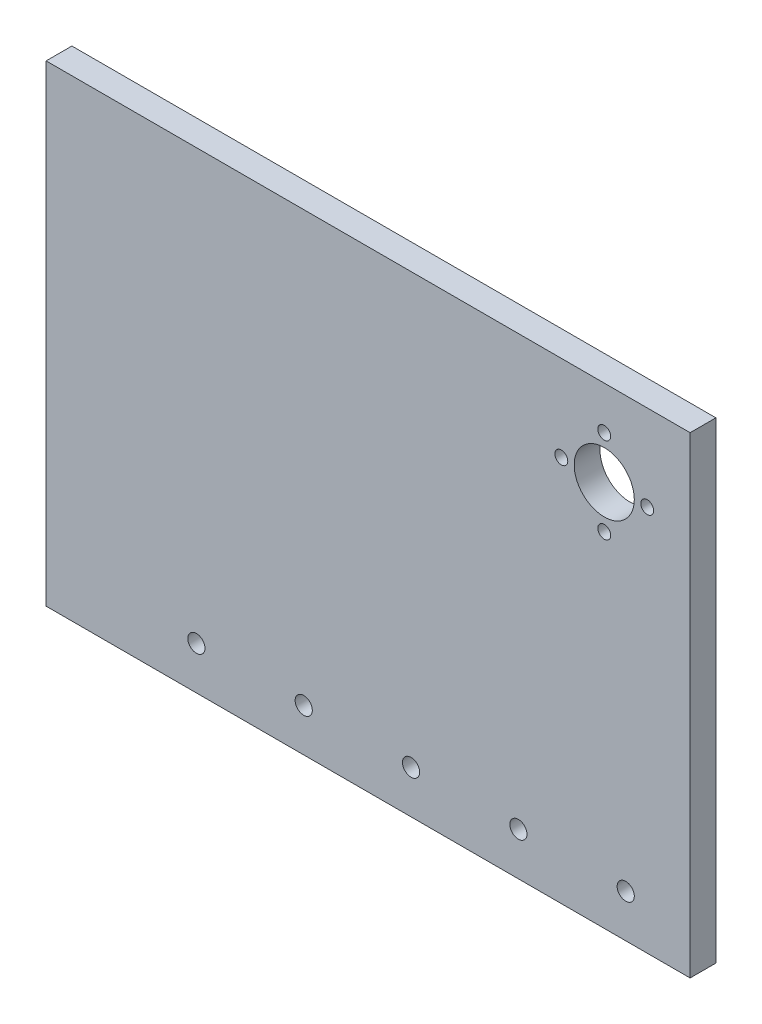
from build123d import *

# Parameters (mm, degrees)
ESQUISSE1_W             = 150
ESQUISSE1_H             = 110
BOSS_EXTRU_1_DEPTH      = 6
ESQUISSE2_R             = 2
ENL_V_MAT_EXTRU_1_DEPTH = 187.107495819
ESQUISSE3_R             = 7
ENL_V_MAT_EXTRU_2_DEPTH = 187.107495819
ESQUISSE4_R             = 1.5
ENL_V_MAT_EXTRU_3_DEPTH = 6


with BuildPart() as part:
    # Esquisse1 → Boss.-Extru.1 (new body)
    with BuildSketch(Plane.XY):
        with Locations((75, 55)):
            Rectangle(ESQUISSE1_W, ESQUISSE1_H)
    extrude(amount=BOSS_EXTRU_1_DEPTH)

    # Esquisse2 → Enlèv. mat.-Extru.1 (cut, through all)
    with BuildSketch(Plane.XY.offset(6)):
        with Locations((110, 10)):
            Circle(ESQUISSE2_R)
        with Locations((135, 10)):
            Circle(ESQUISSE2_R)
        with Locations(Location((35, 10, 0), (0, 0, 180))):
            Circle(ESQUISSE2_R)
        with Locations(Location((60, 10, 0), (0, 0, 180))):
            Circle(ESQUISSE2_R)
        with Locations((85, 10)):
            Circle(ESQUISSE2_R)
    extrude(amount=-ENL_V_MAT_EXTRU_1_DEPTH, mode=Mode.SUBTRACT)

    # Esquisse3 → Enlèv. mat.-Extru.2 (cut, through all)
    with BuildSketch(Plane.XY.offset(6)):
        with Locations((130, 90)):
            Circle(ESQUISSE3_R)
    extrude(amount=-ENL_V_MAT_EXTRU_2_DEPTH, mode=Mode.SUBTRACT)

    # Esquisse4 → Enlèv. mat.-Extru.3 (cut)
    with BuildSketch(Plane.XY.offset(6)):
        with Locations((130, 100)):
            Circle(ESQUISSE4_R)
        with Locations((140, 90)):
            Circle(ESQUISSE4_R)
        with Locations((130, 80)):
            Circle(ESQUISSE4_R)
        with Locations((120, 90)):
            Circle(ESQUISSE4_R)
    extrude(amount=-ENL_V_MAT_EXTRU_3_DEPTH, mode=Mode.SUBTRACT)


solid = part.part
